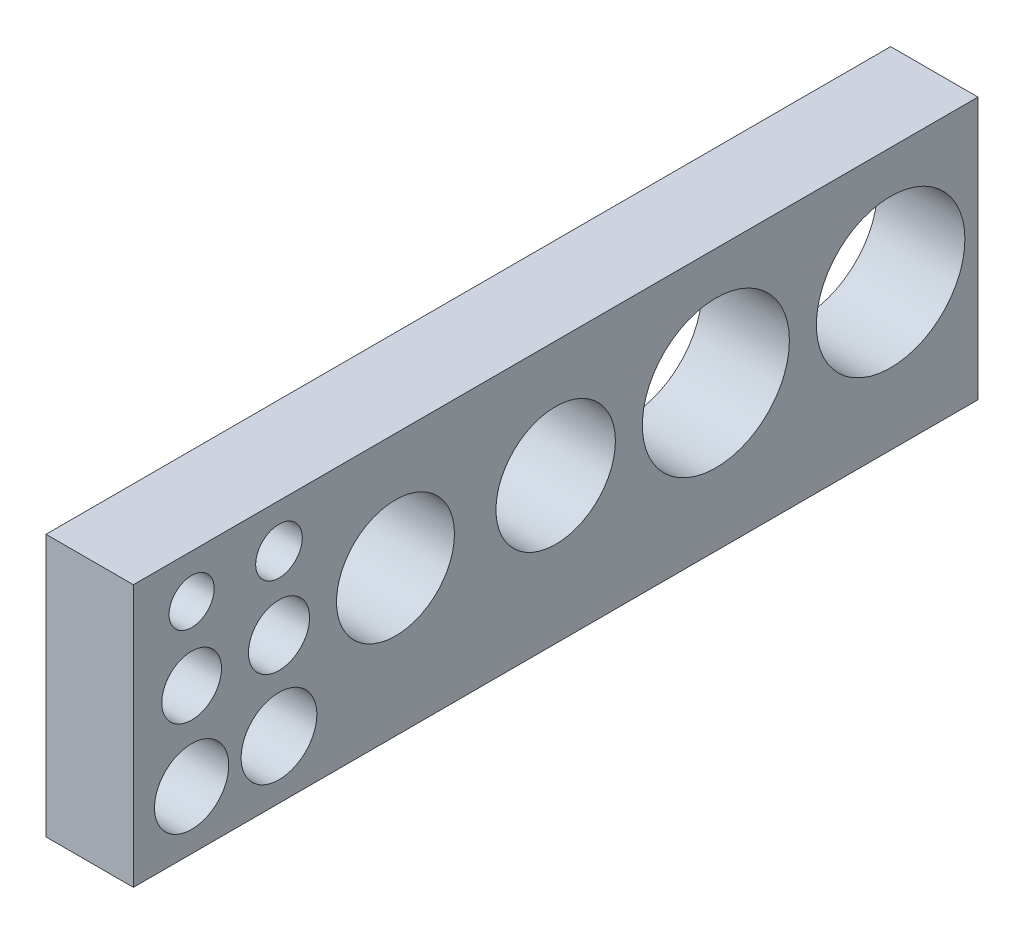
from build123d import *

# Parameters (mm, degrees)
SKETCH_1_W      = 58
SKETCH_1_H      = 18
SKETCH_1_R      = 2.05
SKETCH_1_R_2    = 2.1
SKETCH_1_R_3    = 1.55
SKETCH_1_R_4    = 1.6
SKETCH_1_R_5    = 2.55
SKETCH_1_R_6    = 2.6
SKETCH_1_R_7    = 4.05
SKETCH_1_R_8    = 4.1
SKETCH_1_R_9    = 5.05
SKETCH_1_R_10   = 5.1
EXTRUDE_1_DEPTH = 6


with BuildPart() as part:
    # 草图1 → 凸台-拉伸1 (new body)
    with BuildSketch(Plane(origin=(0, 0, 0), x_dir=(0, 0, -1), z_dir=(1, 0, 0))):
        with Locations((25, -1)):
            Rectangle(SKETCH_1_W, SKETCH_1_H)
        Circle(SKETCH_1_R, mode=Mode.SUBTRACT)
        with Locations((6, 0)):
            Circle(SKETCH_1_R_2, mode=Mode.SUBTRACT)
        with Locations((0, 5)):
            Circle(SKETCH_1_R_3, mode=Mode.SUBTRACT)
        with Locations((6, 5)):
            Circle(SKETCH_1_R_4, mode=Mode.SUBTRACT)
        with Locations((0, -6)):
            Circle(SKETCH_1_R_5, mode=Mode.SUBTRACT)
        with Locations((6, -6)):
            Circle(SKETCH_1_R_6, mode=Mode.SUBTRACT)
        with Locations((14, 0)):
            Circle(SKETCH_1_R_7, mode=Mode.SUBTRACT)
        with Locations((25, 0)):
            Circle(SKETCH_1_R_8, mode=Mode.SUBTRACT)
        with Locations((36, 0)):
            Circle(SKETCH_1_R_9, mode=Mode.SUBTRACT)
        with Locations((48, 0)):
            Circle(SKETCH_1_R_10, mode=Mode.SUBTRACT)
    extrude(amount=EXTRUDE_1_DEPTH)


solid = part.part
